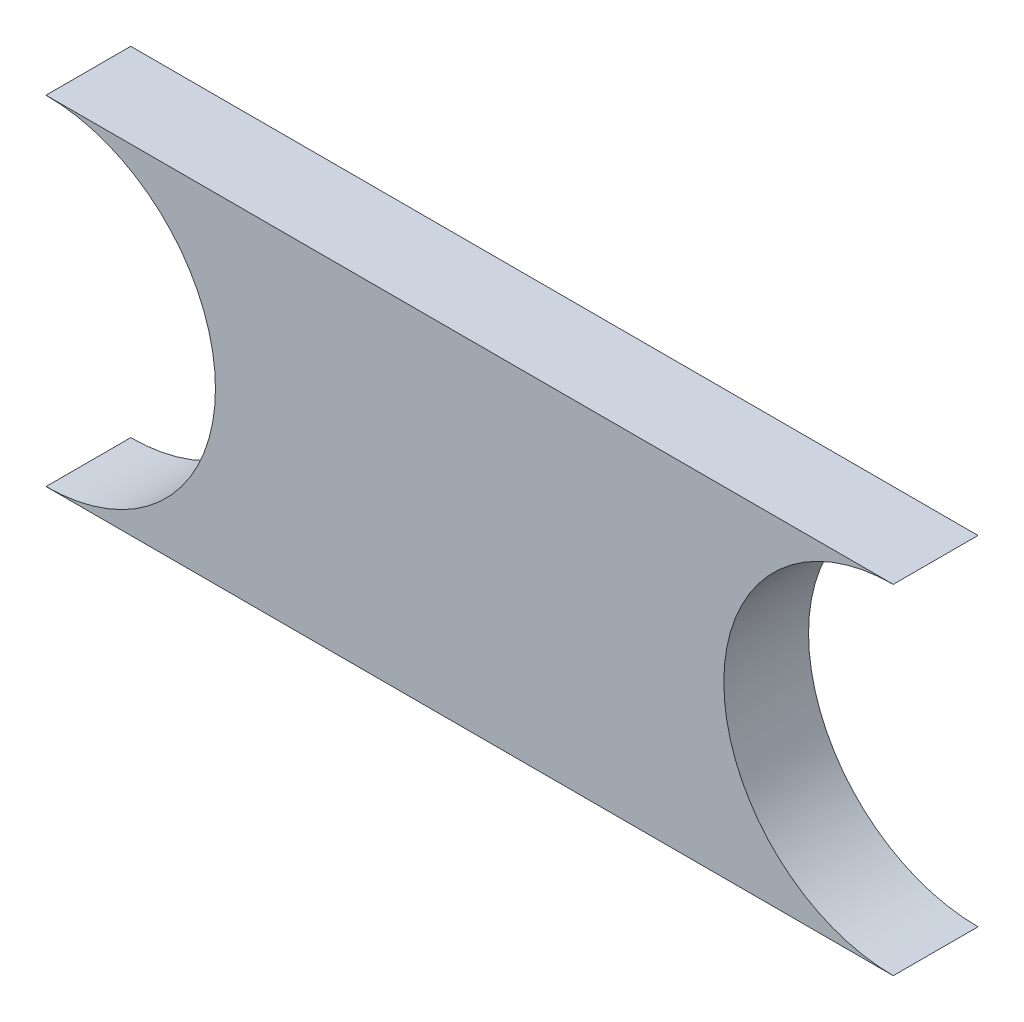
from build123d import *

# Parameters (mm, degrees)
BOSS_EXTRUDE2_DEPTH = 12.7


with BuildPart() as part:
    # Sketch4 → Boss-Extrude2 (new body)
    with BuildSketch(Plane.XY):
        with BuildLine():
            Line((-13.783552668, 25.4), (113.216447332, 25.4))
            ThreePointArc((113.216447332, 25.4), (87.816447332, 0), (113.216447332, -25.4))
            Line((113.216447332, -25.4), (-13.783552668, -25.4))
            ThreePointArc((-13.783552668, -25.4), (11.616447332, 0), (-13.783552668, 25.4))
        make_face()
    extrude(amount=BOSS_EXTRUDE2_DEPTH)


solid = part.part
